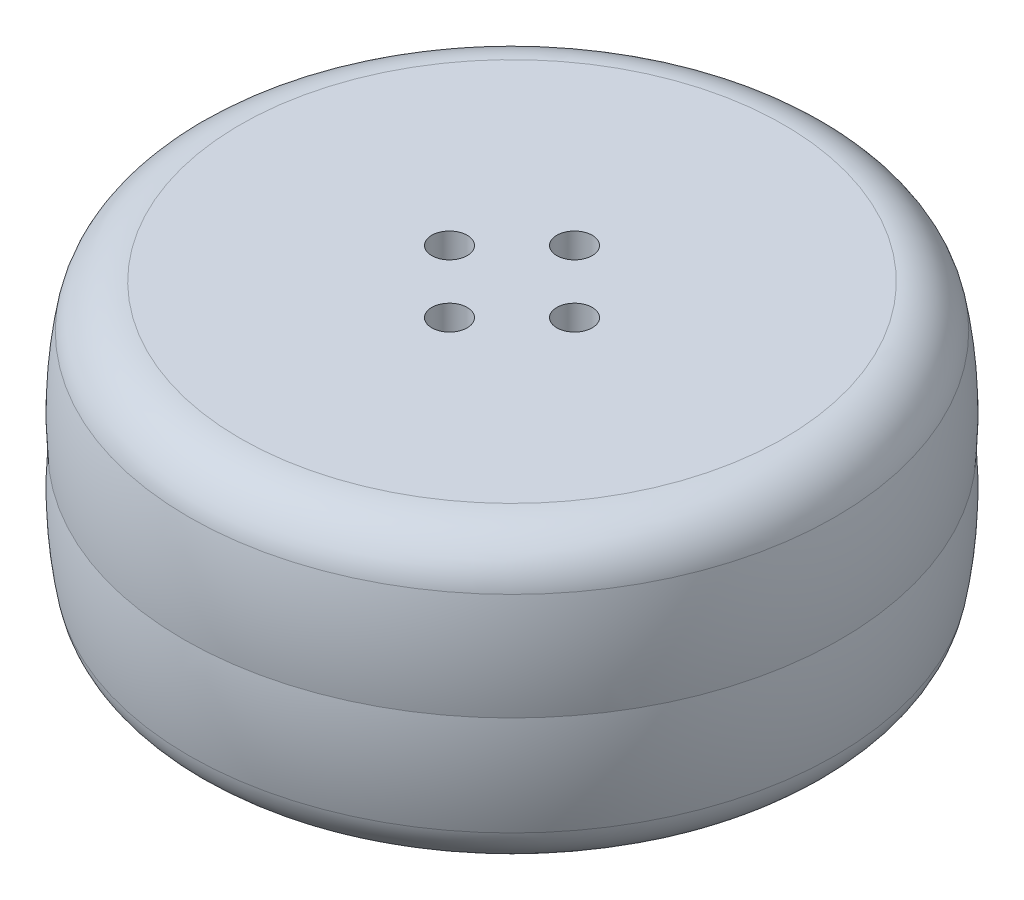
from build123d import *

# Parameters (mm, degrees)
SKETCH2_R          = 1.7
CUT_EXTRUDE1_DEPTH = 10
SKETCH3_R          = 1.751440935
CUT_EXTRUDE2_DEPTH = 10


with BuildPart() as part:
    # Sketch1 → Revolve1 (revolve)
    with BuildSketch(Plane(origin=(0, 0, 0), x_dir=(0, 0, -1), z_dir=(1, 0, 0)), mode=Mode.PRIVATE) as revolve1_sk:
        with BuildLine():
            Line((0, -17.958738126), (0, -31.958738126))
            Line((0, -31.958738126), (31.5, -31.958738126))
            add(Edge.make_bspline(
                [(30.994105567, -22.045911826), (31.600004636, -25.308943196), (31.771214432, -28.644796683), (31.5, -31.958738126)],
                knots=[0.295650736, 0.295650736, 0.295650736, 0.295650736, 1, 1, 1, 1], degree=3))
            ThreePointArc((30.994105567, -22.045911826), (29.274687246, -19.113992913), (26.078136879, -17.958738126))
            Line((26.078136879, -17.958738126), (0, -17.958738126))
        make_face()
    revolve1 = revolve(revolve1_sk.sketch.rotate(Axis((0, -17.958738126, 0), (0, -1, 0)), 180), axis=Axis((0, -17.958738126, 0), (0, -1, 0)))

    # Mirror1: Revolve1 across plane
    add(revolve1.mirror(Plane(origin=(0, -31.958738126, 0), x_dir=(0, 0, 1), z_dir=(0, -1, 0))))

    # Sketch2 → Cut-Extrude1 (cut)
    with BuildSketch(Plane(origin=(0, -17.958738126, 0), x_dir=(1, 0, 0), z_dir=(0, 1, 0))):
        with Locations(Location((-6, 0, 0), (0, 0, 270))):
            Circle(SKETCH2_R)
        with Locations(Location((0, 6, 0), (0, 0, 270))):
            Circle(SKETCH2_R)
        with Locations(Location((6, 0, 0), (0, 0, 270))):
            Circle(SKETCH2_R)
        with Locations(Location((0, -6, 0), (0, 0, 270))):
            Circle(SKETCH2_R)
    extrude(amount=-CUT_EXTRUDE1_DEPTH, mode=Mode.SUBTRACT)

    # Sketch3 → Cut-Extrude2 (cut)
    with BuildSketch(Plane.XZ.offset(45.958738126)):
        with Locations(Location((-21.59, -2.782347586, 0), (0, 0, 270))):
            Circle(SKETCH3_R)
        with Locations(Location((0, 19.569652414, 0), (0, 0, 270))):
            Circle(SKETCH3_R)
        with Locations(Location((21.59, -2.782347586, 0), (0, 0, 270))):
            Circle(SKETCH3_R)
    extrude(amount=-CUT_EXTRUDE2_DEPTH, mode=Mode.SUBTRACT)


solid = part.part
